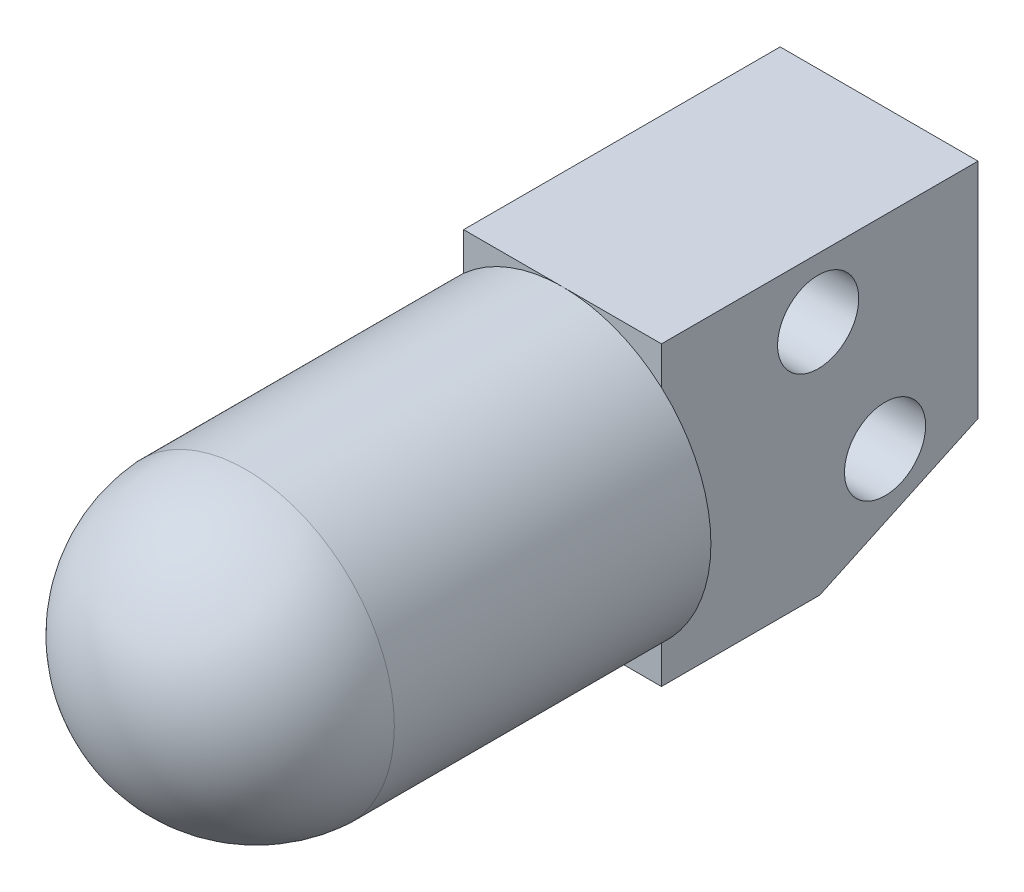
from build123d import *

# Parameters (mm, degrees)
SKETCH_2_R         = 7.5
EXTRUDE_1_DEPTH    = 16
DOME_1_FACE_RADIUS = 7.5
DOME_1_HEIGHT      = 7
SKETCH_3_W         = 10
SKETCH_3_H         = 15
EXTRUDE_2_DEPTH    = 16
CHAMFER_1_SIZE     = 8
CHAMFER_1_SIZE2    = 3.730461265
HOLE_WIZARD_M4_1_D = 4.1


with BuildPart() as part:
    # 草图2 → 凸台-拉伸1 (new body)
    with BuildSketch(Plane.XY):
        Circle(SKETCH_2_R)
    extrude(amount=EXTRUDE_1_DEPTH)

    # 圆顶1: a dome of height H over a round flat face of radius A is a cap of a sphere of radius (A * A + H * H) / (2 * H)
    dome_1_r = (DOME_1_FACE_RADIUS * DOME_1_FACE_RADIUS + DOME_1_HEIGHT * DOME_1_HEIGHT) / (2 * DOME_1_HEIGHT)
    dome_1_base = Plane((0, 0, 16), z_dir=(0, 0, 1))
    with Locations(dome_1_base.offset(DOME_1_HEIGHT - dome_1_r)):
        dome_1_ball = Sphere(dome_1_r, mode=Mode.PRIVATE)
    add(split(dome_1_ball, bisect_by=dome_1_base, keep=Keep.TOP, mode=Mode.PRIVATE))

    # 草图3 → 凸台-拉伸2 (add)
    with BuildSketch(Plane(origin=(0, 0, 0), x_dir=(-1, 0, 0), z_dir=(0, 0, -1))):
        Rectangle(SKETCH_3_W, SKETCH_3_H)
    extrude(amount=EXTRUDE_2_DEPTH)

    # 倒角1
    chamfer_1_edges = [part.edges().sort_by_distance(p)[0] for p in [
        (0, -7.5, -16),
    ]]
    chamfer_1_side = [part.faces().sort_by_distance(p)[0] for p in [
        (0, -7.5, -8),
    ]]
    chamfer(chamfer_1_edges, length=CHAMFER_1_SIZE, length2=CHAMFER_1_SIZE2, reference=chamfer_1_side[0])

    # M4 间隙孔1 (through all)
    with Locations(Plane(origin=(5, 0, 0), x_dir=(0, 0, -1), z_dir=(1, 0, 0))):
        with Locations((7.921197697, 4.5), (11.302143791, -2.750462296)):
            Hole(HOLE_WIZARD_M4_1_D / 2)


solid = part.part
